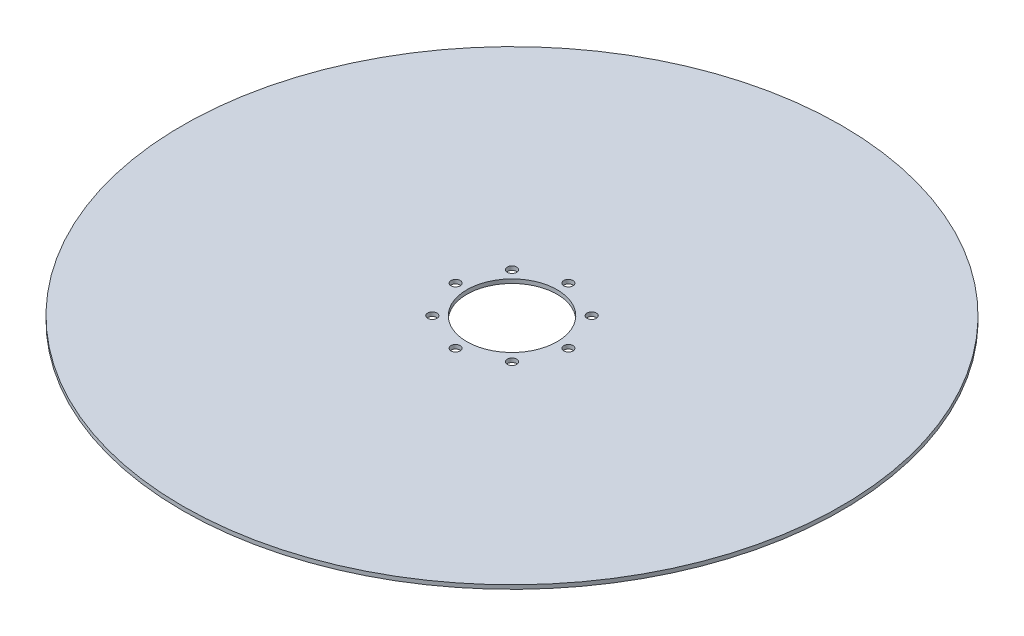
from build123d import *

# Parameters (mm, degrees)
SKETCH1_R         = 124.25
SKETCH1_R_2       = 17
SKETCH1_R_3       = 1.75
EXTRUDE_389_DEPTH = 0.75


with BuildPart() as part:
    # Sketch1 → Extrude 389 (new, symmetric)
    with BuildSketch(Plane(origin=(0, 0, 0), x_dir=(1, 0, 0), z_dir=(0, 1, 0))):
        with Locations(Location((0, 0, 0), (0, 0, 270))):
            Circle(SKETCH1_R)
        with Locations(Location((0, 0, 0), (0, 0, 270))):
            Circle(SKETCH1_R_2, mode=Mode.SUBTRACT)
        with Locations(Location((0, -21.25, 0), (0, 0, 270))):
            Circle(SKETCH1_R_3, mode=Mode.SUBTRACT)
        with Locations(Location((-15.0260191, -15.0260191, 0), (0, 0, 270))):
            Circle(SKETCH1_R_3, mode=Mode.SUBTRACT)
        with Locations(Location((-21.25, 0, 0), (0, 0, 270))):
            Circle(SKETCH1_R_3, mode=Mode.SUBTRACT)
        with Locations(Location((-15.0260191, 15.0260191, 0), (0, 0, 270))):
            Circle(SKETCH1_R_3, mode=Mode.SUBTRACT)
        with Locations(Location((0, 21.25, 0), (0, 0, 270))):
            Circle(SKETCH1_R_3, mode=Mode.SUBTRACT)
        with Locations(Location((15.0260191, 15.0260191, 0), (0, 0, 270))):
            Circle(SKETCH1_R_3, mode=Mode.SUBTRACT)
        with Locations(Location((21.25, 0, 0), (0, 0, 270))):
            Circle(SKETCH1_R_3, mode=Mode.SUBTRACT)
        with Locations(Location((15.0260191, -15.0260191, 0), (0, 0, 270))):
            Circle(SKETCH1_R_3, mode=Mode.SUBTRACT)
    extrude(amount=EXTRUDE_389_DEPTH, both=True)


solid = part.part
